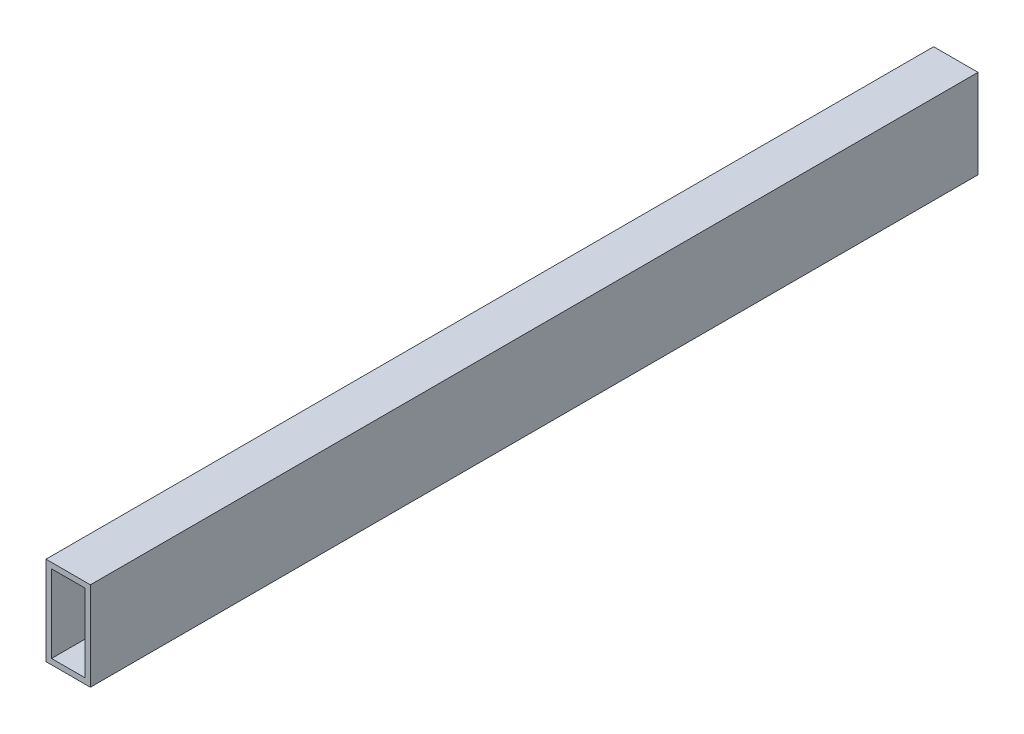
from build123d import *

# Parameters (mm, degrees)
SKETCH1_W           = 25.4
SKETCH1_H           = 50.8
SKETCH1_W_2         = 19.05
SKETCH1_H_2         = 44.45
BOSS_EXTRUDE1_DEPTH = 508


with BuildPart() as part:
    # Sketch1 → Boss-Extrude1 (new body)
    with BuildSketch(Plane.XY):
        with Locations((-12.7, 25.4)):
            Rectangle(SKETCH1_W, SKETCH1_H)
        with Locations((-12.7, 25.4)):
            Rectangle(SKETCH1_W_2, SKETCH1_H_2, mode=Mode.SUBTRACT)
    extrude(amount=BOSS_EXTRUDE1_DEPTH)


solid = part.part
